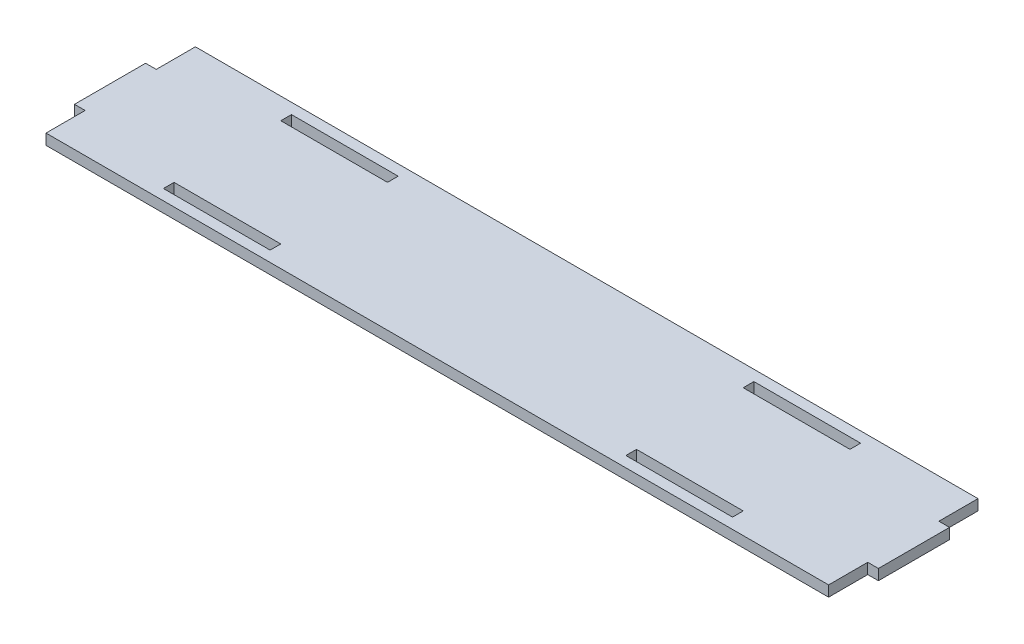
from build123d import *

# Parameters (mm, degrees)
SKETCH1_W           = 30
SKETCH1_H           = 3
BOSS_EXTRUDE1_DEPTH = 3


with BuildPart() as part:
    # Sketch1 → Boss-Extrude1 (new body)
    with BuildSketch(Plane(origin=(0, 0, 0), x_dir=(1, 0, 0), z_dir=(0, 1, 0))):
        Polygon((0, 0), (220, 0), (220, 11), (223, 11), (223, 31), (220, 31), (220, 42), (0, 42), (0, 31), (-3, 31), (-3, 11), (0, 11), align=None)
        with Locations((45, 37.5)):
            Rectangle(SKETCH1_W, SKETCH1_H, mode=Mode.SUBTRACT)
        with Locations((175, 37.5)):
            Rectangle(SKETCH1_W, SKETCH1_H, mode=Mode.SUBTRACT)
        with Locations((175, 4.5)):
            Rectangle(SKETCH1_W, SKETCH1_H, mode=Mode.SUBTRACT)
        with Locations((45, 4.5)):
            Rectangle(SKETCH1_W, SKETCH1_H, mode=Mode.SUBTRACT)
    extrude(amount=BOSS_EXTRUDE1_DEPTH)


solid = part.part
